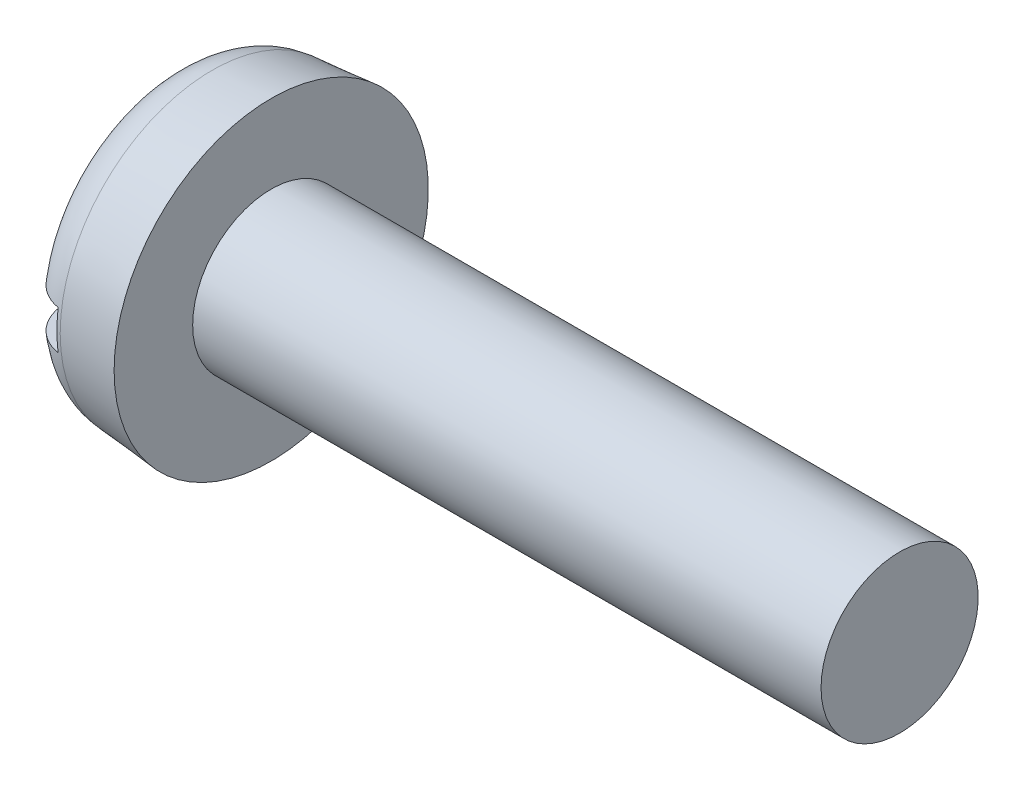
from build123d import *

# Parameters (mm, degrees)
FILLET2_R  = 0.6
SKETCH2_W  = 4
SKETCH2_H  = 0.5
SLOT_DEPTH = 0.5


with BuildPart() as part:
    # BodySke → Base-Revolve (revolve)
    with BuildSketch(Plane.XY, mode=Mode.PRIVATE) as base_revolve_sk:
        Polygon((1.3, 1), (1.3, 2), (0, 1.886264737), (0, 0), (9.3, 0), (9.3, 1), align=None)
    revolve(base_revolve_sk.sketch.rotate(Axis((-25.4, 0, 0), (1, 0, 0)), 90), axis=Axis((-25.4, 0, 0), (1, 0, 0)))

    # Fillet2
    fillet2_edges = [part.edges().sort_by_distance(p)[0] for p in [
        (0, 0, -1.886264737),
    ]]
    fillet(fillet2_edges, radius=FILLET2_R)

    # Sketch2 → Slot (cut)
    with BuildSketch(Plane(origin=(0, 0, 0), x_dir=(0, 0, -1), z_dir=(1, 0, 0))):
        Rectangle(SKETCH2_W, SKETCH2_H)
    extrude(amount=SLOT_DEPTH, mode=Mode.SUBTRACT)


solid = part.part
